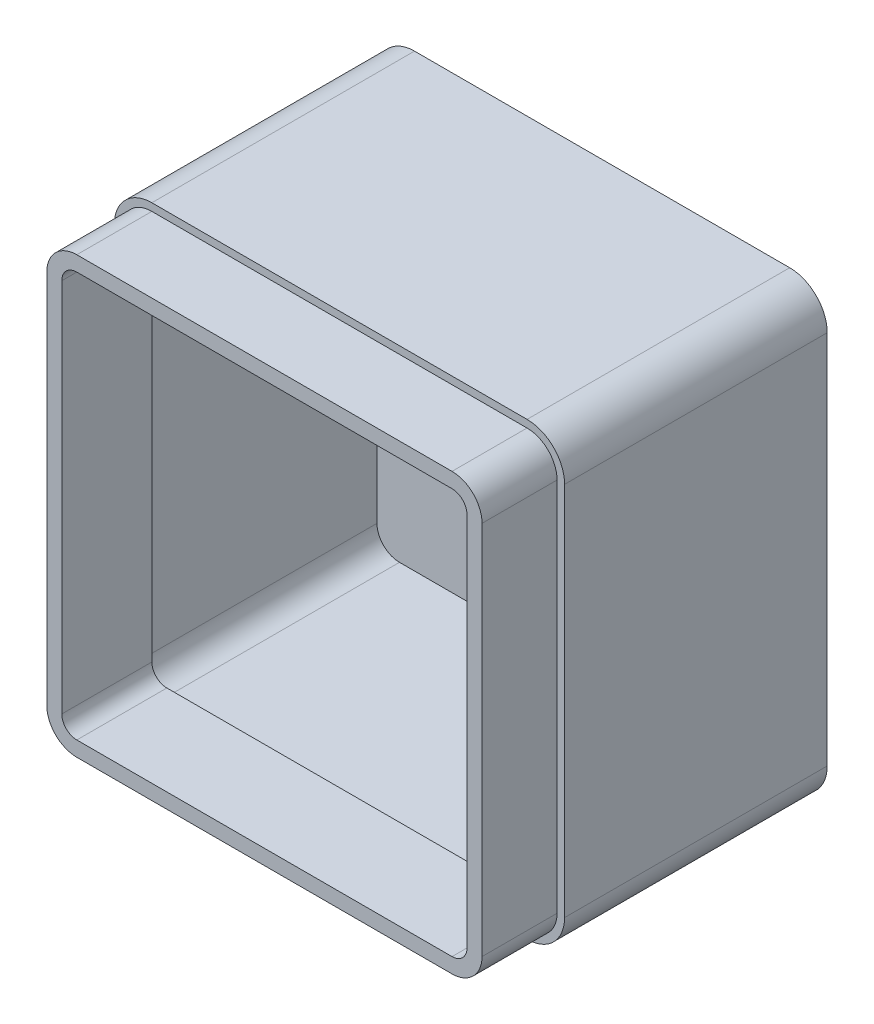
from build123d import *

# Parameters (mm, degrees)
SKETCH1_W           = 120
SKETCH1_H           = 120
BOSS_EXTRUDE1_DEPTH = 90
FILLET1_R           = 10
CUT_EXTRUDE4_DEPTH  = 20
SHELL1_T            = -4


with BuildPart() as part:
    # Sketch1 → Boss-Extrude1 (new body)
    with BuildSketch(Plane.XY):
        Rectangle(SKETCH1_W, SKETCH1_H)
    extrude(amount=BOSS_EXTRUDE1_DEPTH)

    # Fillet1
    fillet1_edges = [part.edges().sort_by_distance(p)[0] for p in [
        (60, -60, 45),
        (-60, -60, 45),
        (-60, 60, 45),
        (60, 60, 45),
    ]]
    fillet(fillet1_edges, radius=FILLET1_R)

    # Sketch4 → Cut-Extrude4 (cut)
    with BuildSketch(Plane.XY.offset(90)):
        with BuildLine():
            Line((-60, 50), (-60, -50))
            ThreePointArc((-60, -50), (-57.071067812, -57.071067812), (-50, -60))
            Line((-50, -60), (50, -60))
            ThreePointArc((50, -60), (57.071067812, -57.071067812), (60, -50))
            Line((60, -50), (60, 50))
            ThreePointArc((60, 50), (57.071067812, 57.071067812), (50, 60))
            Line((50, 60), (-50, 60))
            ThreePointArc((-50, 60), (-57.071067812, 57.071067812), (-60, 50))
        make_face()
        with BuildLine():
            Line((-58, 50), (-58, -50))
            ThreePointArc((-58, -50), (-55.656854249, -55.656854249), (-50, -58))
            Line((-50, -58), (50, -58))
            ThreePointArc((50, -58), (55.656854249, -55.656854249), (58, -50))
            Line((58, -50), (58, 50))
            ThreePointArc((58, 50), (55.656854249, 55.656854249), (50, 58))
            Line((50, 58), (-50, 58))
            ThreePointArc((-50, 58), (-55.656854249, 55.656854249), (-58, 50))
        make_face(mode=Mode.SUBTRACT)
    extrude(amount=-CUT_EXTRUDE4_DEPTH, mode=Mode.SUBTRACT)

    # Shell1
    shell1_openings = [part.faces().sort_by_distance(p)[0] for p in [
        (0, 0, 90),
    ]]
    offset(amount=SHELL1_T, openings=shell1_openings, kind=Kind.INTERSECTION)


solid = part.part
